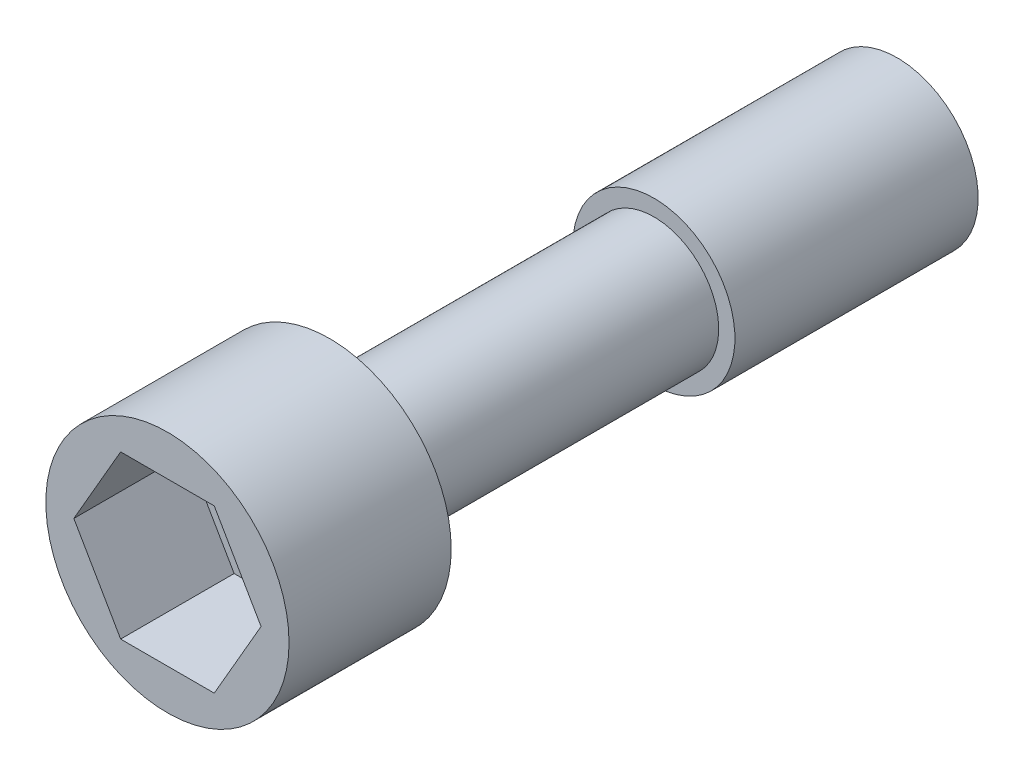
from build123d import *

# Parameters (mm, degrees)
SKETCH1_R           = 7.5
BOSS_EXTRUDE1_DEPTH = 10
SKETCH2_R           = 4
BOSS_EXTRUDE2_DEPTH = 20
SKETCH3_R           = 5
BOSS_EXTRUDE3_DEPTH = 15
CUT_EXTRUDE1_DEPTH  = 7


with BuildPart() as part:
    # Sketch1 → Boss-Extrude1 (new body)
    with BuildSketch(Plane.XY):
        Circle(SKETCH1_R)
    extrude(amount=BOSS_EXTRUDE1_DEPTH)

    # Sketch2 → Boss-Extrude2 (add)
    with BuildSketch(Plane(origin=(0, 0, 0), x_dir=(-1, 0, 0), z_dir=(0, 0, -1))):
        Circle(SKETCH2_R)
    extrude(amount=BOSS_EXTRUDE2_DEPTH)

    # Sketch3 → Boss-Extrude3 (add)
    with BuildSketch(Plane(origin=(0, 0, -20), x_dir=(-1, 0, 0), z_dir=(0, 0, -1))):
        Circle(SKETCH3_R)
    extrude(amount=BOSS_EXTRUDE3_DEPTH)

    # Sketch4 → Cut-Extrude1 (cut)
    with BuildSketch(Plane.XY.offset(10)):
        Polygon((2.886751346, 5), (-2.886751346, 5), (-5.773502692, 0), (-2.886751346, -5), (2.886751346, -5), (5.773502692, 0), align=None)
    extrude(amount=-CUT_EXTRUDE1_DEPTH, mode=Mode.SUBTRACT)


solid = part.part
